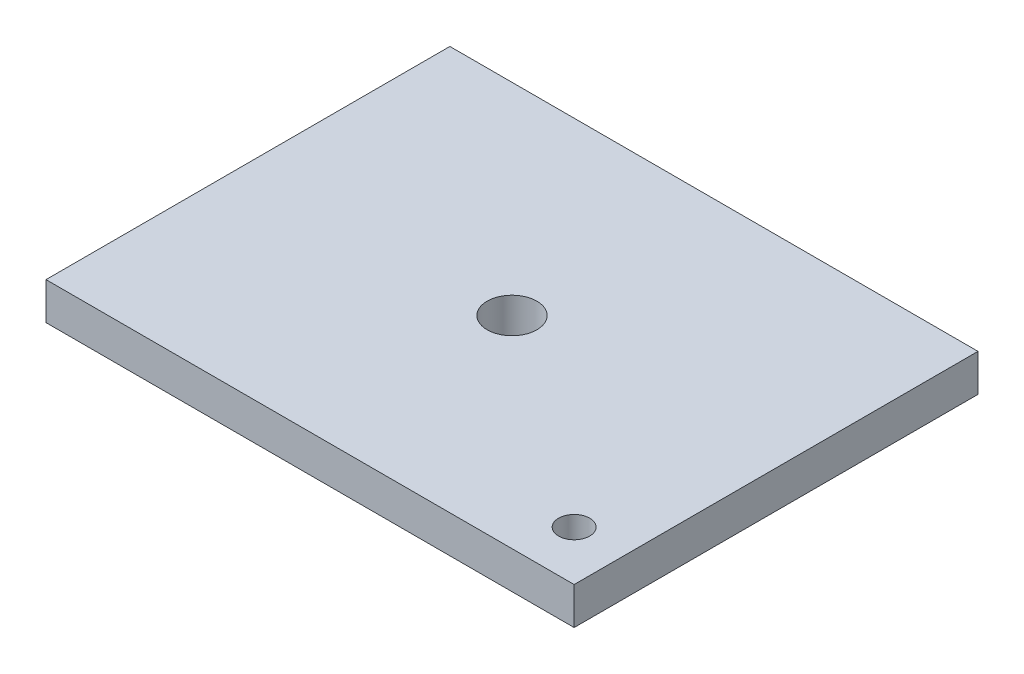
from build123d import *

# Parameters (mm, degrees)
SKETCH_1_W          = 85
SKETCH_1_H          = 65
SKETCH_1_R          = 4
EXTRUDE_1_DEPTH     = 6
SKETCH_2_R          = 2.5
CUT_EXTRUDE_1_DEPTH = 108.172757733


with BuildPart() as part:
    # Эскиз1 → Вытянуть1 (new body)
    with BuildSketch(Plane(origin=(0, 0, 0), x_dir=(1, 0, 0), z_dir=(0, 1, 0))):
        with Locations((42.5, -32.5)):
            Rectangle(SKETCH_1_W, SKETCH_1_H)
        with Locations(Location((42.5, -32.5, 0), (0, 0, 270))):
            Circle(SKETCH_1_R, mode=Mode.SUBTRACT)
    extrude(amount=EXTRUDE_1_DEPTH)

    # Эскиз2 → Вырез-Вытянуть1 (cut, through all)
    with BuildSketch(Plane(origin=(0, 6, 0), x_dir=(1, 0, 0), z_dir=(0, 1, 0))):
        with Locations(Location((77, -57, 0), (0, 0, 270))):
            Circle(SKETCH_2_R)
    extrude(amount=-CUT_EXTRUDE_1_DEPTH, mode=Mode.SUBTRACT)


solid = part.part
